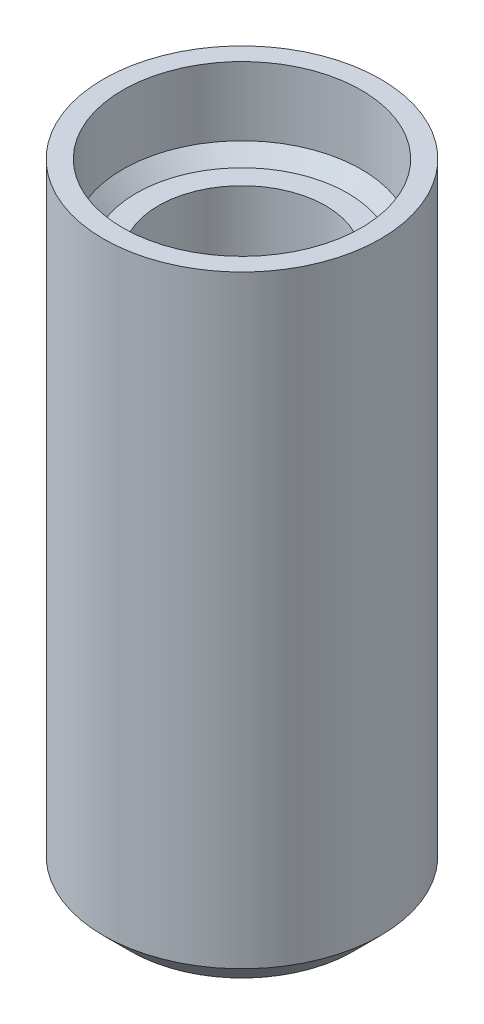
from build123d import *

# Parameters (mm, degrees)
SKETCH1_R           = 5.05
BOSS_EXTRUDE1_DEPTH = 20
SKETCH2_R           = 5.05
BOSS_EXTRUDE2_DEPTH = 2
SKETCH4_R           = 5.05
SKETCH4_R_2         = 4.35
BOSS_EXTRUDE3_DEPTH = 3
CHAMFER1_SIZE       = 1
CHAMFER2_SIZE       = 0.5
CUT_EXTRUDE1_DEPTH  = 0.4
BOSS_EXTRUDE4_DEPTH = 0.4


with BuildPart() as part:
    # Sketch1 → Boss-Extrude1 (new body)
    with BuildSketch(Plane(origin=(0, 0, 0), x_dir=(1, 0, 0), z_dir=(0, 1, 0))):
        Circle(SKETCH1_R)
        with BuildLine():
            Line((2.565151068, -1.65), (-2.565151068, -1.65))
            ThreePointArc((-2.565151068, -1.65), (0, 3.05), (2.565151068, -1.65))
        make_face(mode=Mode.SUBTRACT)
    extrude(amount=BOSS_EXTRUDE1_DEPTH)

    # Sketch2 → Boss-Extrude2 (add)
    with BuildSketch(Plane.XZ):
        Circle(SKETCH2_R)
    extrude(amount=-BOSS_EXTRUDE2_DEPTH)

    # Sketch4 → Boss-Extrude3 (add)
    with BuildSketch(Plane(origin=(0, 20, 0), x_dir=(1, 0, 0), z_dir=(0, 1, 0))):
        Circle(SKETCH4_R)
        Circle(SKETCH4_R_2, mode=Mode.SUBTRACT)
    extrude(amount=BOSS_EXTRUDE3_DEPTH)

    # Chamfer1
    chamfer1_edges = [part.edges().sort_by_distance(p)[0] for p in [
        (-5.05, 0, 0),
    ]]
    chamfer(chamfer1_edges, length=CHAMFER1_SIZE)

    # Chamfer2
    chamfer2_edges = [part.edges().sort_by_distance(p)[0] for p in [
        (-4.35, 20, 0),
    ]]
    chamfer(chamfer2_edges, length=CHAMFER2_SIZE)

    # Sketch5 → Cut-Extrude1 (cut)
    with BuildSketch(Plane.XZ):
        with BuildLine():
            add(Edge.make_bspline(
                [(1.503946302, -1.646012639), (1.503796634, -1.675709231), (1.503520327, -1.730533461), (1.495832603, -1.805869401), (1.487293188, -1.868599812), (1.472061145, -1.918250208), (1.45431425, -1.957451391), (1.427848022, -1.98313015), (1.397106461, -1.996710383), (1.37573713, -1.998896559), (1.364951265, -2)],
                knots=[0, 0, 0, 0, 1.700477232, 3.139328327, 4.338937117, 5.31779253, 6.112293145, 6.774269824, 7.381330181, 8, 8, 8, 8], degree=3))
            Line((1.364951265, -2), (-1.157958655, -2))
            add(Edge.make_bspline(
                [(-1.157958655, -2), (-1.181313286, -1.999513937), (-1.224943688, -1.998605888), (-1.285890084, -1.989774463), (-1.337523453, -1.969798779), (-1.37949423, -1.935892981), (-1.408860562, -1.885251871), (-1.4282837, -1.818630591), (-1.437844273, -1.733279924), (-1.439198719, -1.670030244), (-1.439948587, -1.635013032)],
                knots=[0, 0, 0, 0, 1.025949817, 1.916647791, 2.69162005, 3.43032923, 4.23901448, 5.220859075, 6.461371377, 8, 8, 8, 8], degree=3))
            add(Edge.make_bspline(
                [(-1.439948587, -1.635013032), (-1.439245035, -1.601007994), (-1.437946587, -1.538249658), (-1.431888841, -1.450483653), (-1.418165094, -1.374786106), (-1.395715272, -1.307311278), (-1.363372901, -1.246306319), (-1.325730064, -1.184944159), (-1.275906436, -1.123330328), (-1.238197207, -1.082141796), (-1.217956513, -1.060033561)],
                knots=[0, 0, 0, 0, 1.279770231, 2.361892714, 3.306414937, 4.167028953, 5.025172171, 5.898575693, 6.872045744, 8, 8, 8, 8], degree=3))
            Line((-1.217956513, -1.060033561), (-0.476982969, -0.264061981))
            add(Edge.make_bspline(
                [(-0.476982969, -0.264061981), (-0.441772073, -0.225587056), (-0.373682014, -0.151185089), (-0.27859937, -0.040435139), (-0.19460351, 0.06536146), (-0.121175016, 0.165976738), (-0.056513558, 0.261746), (-0.000109902, 0.352985079), (0.049805762, 0.439759759), (0.104121058, 0.547034863), (0.15661464, 0.673242398), (0.197776339, 0.818084735), (0.219343407, 0.952548313), (0.222480508, 1.039159601), (0.223992002, 1.080889997)],
                knots=[0, 0, 0, 0, 1.20947157, 2.338849612, 3.384319872, 4.341377303, 5.226828348, 6.063423144, 6.828539773, 7.547598628, 8.851019864, 9.991402106, 11.032232556, 12, 12, 12, 12], degree=3))
            add(Edge.make_bspline(
                [(0.223992002, 1.080889997), (0.222220689, 1.114393803), (0.218711767, 1.180763892), (0.192050769, 1.276220615), (0.149092524, 1.364067272), (0.086764758, 1.439677843), (0.008353365, 1.503649766), (-0.089048018, 1.549215472), (-0.20359379, 1.579115128), (-0.286110329, 1.582220675), (-0.329988218, 1.583872038)],
                knots=[0, 0, 0, 0, 0.952592796, 1.887059298, 2.799298945, 3.716508085, 4.654435942, 5.655858967, 6.753510967, 8, 8, 8, 8], degree=3))
            add(Edge.make_bspline(
                [(-0.329988218, 1.583872038), (-0.362005104, 1.583306935), (-0.424172808, 1.582209663), (-0.514874087, 1.57340374), (-0.599665222, 1.557205823), (-0.702930583, 1.529683381), (-0.81907888, 1.486687777), (-0.942649229, 1.428835108), (-1.047088338, 1.370419263), (-1.122366572, 1.32500387), (-1.172462711, 1.292012095), (-1.205137878, 1.277565428), (-1.232842043, 1.265883101), (-1.250868706, 1.264502686), (-1.258955049, 1.263883464)],
                knots=[0, 0, 0, 0, 1.155956231, 2.244538859, 3.28550842, 4.269318886, 6.100628768, 7.748195433, 9.191883973, 10.417953324, 10.925724687, 11.351067817, 11.708904068, 12, 12, 12, 12], degree=3))
            add(Edge.make_bspline(
                [(-1.258955049, 1.263883464), (-1.268547005, 1.264741423), (-1.287866311, 1.266469454), (-1.313745241, 1.284987713), (-1.333989674, 1.314859809), (-1.348244132, 1.358394834), (-1.359473666, 1.416162587), (-1.369532054, 1.490259329), (-1.375006138, 1.581791826), (-1.375617813, 1.648529508), (-1.375950872, 1.684868432)],
                knots=[0, 0, 0, 0, 0.485692822, 0.97824142, 1.565816375, 2.311318477, 3.305989244, 4.581102635, 6.138397226, 8, 8, 8, 8], degree=3))
            add(Edge.make_bspline(
                [(-1.375950872, 1.684868432), (-1.375937002, 1.709545239), (-1.375911861, 1.75427285), (-1.371523326, 1.815972977), (-1.366099701, 1.867524035), (-1.357104509, 1.911433051), (-1.345047238, 1.948985947), (-1.329254918, 1.983916951), (-1.303909621, 2.018746992), (-1.275231611, 2.050212392), (-1.241920999, 2.078117721), (-1.20701747, 2.102610932), (-1.163511995, 2.130041563), (-1.089415303, 2.169731561), (-0.979826679, 2.223031825), (-0.827501283, 2.280650326), (-0.65431417, 2.333995035), (-0.463979338, 2.379209561), (-0.260322783, 2.410454495), (-0.120112449, 2.414029237), (-0.048998251, 2.415842333)],
                knots=[0, 0, 0, 0, 0.788292368, 1.428808632, 1.975788089, 2.443732868, 2.858052408, 3.234493626, 3.66294862, 4.228288178, 4.591069522, 5.049213324, 5.590039132, 6.233559628, 7.734267659, 9.480939635, 11.431700141, 13.521863135, 15.728704436, 18, 18, 18, 18], degree=3))
            add(Edge.make_bspline(
                [(-0.048998251, 2.415842333), (0.006376737, 2.415033437), (0.113708469, 2.413465576), (0.269501976, 2.397082983), (0.414556565, 2.370915897), (0.548479175, 2.332310402), (0.671597029, 2.285498209), (0.784570996, 2.230714038), (0.886048284, 2.16643306), (0.976827094, 2.09388449), (1.0567917, 2.014173678), (1.126183469, 1.926723625), (1.183750038, 1.831780782), (1.231167288, 1.730209238), (1.266736398, 1.622963463), (1.292559642, 1.511830329), (1.309510379, 1.396730746), (1.311129708, 1.318608879), (1.311953157, 1.278882928)],
                knots=[0, 0, 0, 0, 1.324900052, 2.568015312, 3.744666331, 4.8481595, 5.898614886, 6.894039723, 7.847934722, 8.767415271, 9.669989851, 10.544631889, 11.43259769, 12.321315746, 13.221949113, 14.131442766, 15.049815173, 16, 16, 16, 16], degree=3))
            add(Edge.make_bspline(
                [(1.311953157, 1.278882928), (1.309995892, 1.208454352), (1.306091411, 1.067958786), (1.280552537, 0.892942461), (1.24830755, 0.752470187), (1.210908684, 0.644005984), (1.165445165, 0.530557794), (1.106374763, 0.413589462), (1.036919583, 0.290614629), (0.954715609, 0.16184909), (0.859436164, 0.026864235), (0.75033226, -0.11494206), (0.626236799, -0.266261019), (0.484161484, -0.427999209), (0.322760295, -0.60074129), (0.207885943, -0.718597632), (0.147994716, -0.780043558)],
                knots=[0, 0, 0, 0, 1.214695824, 2.423155294, 3.043825433, 3.698462194, 4.400034292, 5.150962269, 5.956941602, 6.835925221, 7.785176393, 8.806499493, 9.921972916, 11.160753287, 12.51972206, 14, 14, 14, 14], degree=3))
            Line((0.147994716, -0.780043558), (-0.351987432, -1.296025135))
            Line((-0.351987432, -1.296025135), (1.353951657, -1.296025135))
            add(Edge.make_bspline(
                [(1.353951657, -1.296025135), (1.364825015, -1.296947224), (1.386659484, -1.298798843), (1.416925115, -1.31580015), (1.444699437, -1.341104261), (1.466398067, -1.379302909), (1.484653853, -1.428051082), (1.495116283, -1.490023895), (1.503684812, -1.563773668), (1.503855039, -1.61731039), (1.503946302, -1.646012639)],
                knots=[0, 0, 0, 0, 0.620001289, 1.24500623, 1.94939785, 2.757032326, 3.738367869, 4.928457297, 6.353276405, 8, 8, 8, 8], degree=3))
        make_face()
    extrude(amount=-CUT_EXTRUDE1_DEPTH, mode=Mode.SUBTRACT)


with BuildPart() as body_2:
    # Sketch5<2> → Boss-Extrude4 (new body)
    with BuildSketch(Plane.XZ):
        with BuildLine():
            add(Edge.make_bspline(
                [(1.503946302, -1.646012639), (1.503796634, -1.675709231), (1.503520327, -1.730533461), (1.495832603, -1.805869401), (1.487293188, -1.868599812), (1.472061145, -1.918250208), (1.45431425, -1.957451391), (1.427848022, -1.98313015), (1.397106461, -1.996710383), (1.37573713, -1.998896559), (1.364951265, -2)],
                knots=[0, 0, 0, 0, 1.700477232, 3.139328327, 4.338937117, 5.31779253, 6.112293145, 6.774269824, 7.381330181, 8, 8, 8, 8], degree=3))
            Line((1.364951265, -2), (-1.157958655, -2))
            add(Edge.make_bspline(
                [(-1.157958655, -2), (-1.181313286, -1.999513937), (-1.224943688, -1.998605888), (-1.285890084, -1.989774463), (-1.337523453, -1.969798779), (-1.37949423, -1.935892981), (-1.408860562, -1.885251871), (-1.4282837, -1.818630591), (-1.437844273, -1.733279924), (-1.439198719, -1.670030244), (-1.439948587, -1.635013032)],
                knots=[0, 0, 0, 0, 1.025949817, 1.916647791, 2.69162005, 3.43032923, 4.23901448, 5.220859075, 6.461371377, 8, 8, 8, 8], degree=3))
            add(Edge.make_bspline(
                [(-1.439948587, -1.635013032), (-1.439245035, -1.601007994), (-1.437946587, -1.538249658), (-1.431888841, -1.450483653), (-1.418165094, -1.374786106), (-1.395715272, -1.307311278), (-1.363372901, -1.246306319), (-1.325730064, -1.184944159), (-1.275906436, -1.123330328), (-1.238197207, -1.082141796), (-1.217956513, -1.060033561)],
                knots=[0, 0, 0, 0, 1.279770231, 2.361892714, 3.306414937, 4.167028953, 5.025172171, 5.898575693, 6.872045744, 8, 8, 8, 8], degree=3))
            Line((-1.217956513, -1.060033561), (-0.476982969, -0.264061981))
            add(Edge.make_bspline(
                [(-0.476982969, -0.264061981), (-0.441772073, -0.225587056), (-0.373682014, -0.151185089), (-0.27859937, -0.040435139), (-0.19460351, 0.06536146), (-0.121175016, 0.165976738), (-0.056513558, 0.261746), (-0.000109902, 0.352985079), (0.049805762, 0.439759759), (0.104121058, 0.547034863), (0.15661464, 0.673242398), (0.197776339, 0.818084735), (0.219343407, 0.952548313), (0.222480508, 1.039159601), (0.223992002, 1.080889997)],
                knots=[0, 0, 0, 0, 1.20947157, 2.338849612, 3.384319872, 4.341377303, 5.226828348, 6.063423144, 6.828539773, 7.547598628, 8.851019864, 9.991402106, 11.032232556, 12, 12, 12, 12], degree=3))
            add(Edge.make_bspline(
                [(0.223992002, 1.080889997), (0.222220689, 1.114393803), (0.218711767, 1.180763892), (0.192050769, 1.276220615), (0.149092524, 1.364067272), (0.086764758, 1.439677843), (0.008353365, 1.503649766), (-0.089048018, 1.549215472), (-0.20359379, 1.579115128), (-0.286110329, 1.582220675), (-0.329988218, 1.583872038)],
                knots=[0, 0, 0, 0, 0.952592796, 1.887059298, 2.799298945, 3.716508085, 4.654435942, 5.655858967, 6.753510967, 8, 8, 8, 8], degree=3))
            add(Edge.make_bspline(
                [(-0.329988218, 1.583872038), (-0.362005104, 1.583306935), (-0.424172808, 1.582209663), (-0.514874087, 1.57340374), (-0.599665222, 1.557205823), (-0.702930583, 1.529683381), (-0.81907888, 1.486687777), (-0.942649229, 1.428835108), (-1.047088338, 1.370419263), (-1.122366572, 1.32500387), (-1.172462711, 1.292012095), (-1.205137878, 1.277565428), (-1.232842043, 1.265883101), (-1.250868706, 1.264502686), (-1.258955049, 1.263883464)],
                knots=[0, 0, 0, 0, 1.155956231, 2.244538859, 3.28550842, 4.269318886, 6.100628768, 7.748195433, 9.191883973, 10.417953324, 10.925724687, 11.351067817, 11.708904068, 12, 12, 12, 12], degree=3))
            add(Edge.make_bspline(
                [(-1.258955049, 1.263883464), (-1.268547005, 1.264741423), (-1.287866311, 1.266469454), (-1.313745241, 1.284987713), (-1.333989674, 1.314859809), (-1.348244132, 1.358394834), (-1.359473666, 1.416162587), (-1.369532054, 1.490259329), (-1.375006138, 1.581791826), (-1.375617813, 1.648529508), (-1.375950872, 1.684868432)],
                knots=[0, 0, 0, 0, 0.485692822, 0.97824142, 1.565816375, 2.311318477, 3.305989244, 4.581102635, 6.138397226, 8, 8, 8, 8], degree=3))
            add(Edge.make_bspline(
                [(-1.375950872, 1.684868432), (-1.375937002, 1.709545239), (-1.375911861, 1.75427285), (-1.371523326, 1.815972977), (-1.366099701, 1.867524035), (-1.357104509, 1.911433051), (-1.345047238, 1.948985947), (-1.329254918, 1.983916951), (-1.303909621, 2.018746992), (-1.275231611, 2.050212392), (-1.241920999, 2.078117721), (-1.20701747, 2.102610932), (-1.163511995, 2.130041563), (-1.089415303, 2.169731561), (-0.979826679, 2.223031825), (-0.827501283, 2.280650326), (-0.65431417, 2.333995035), (-0.463979338, 2.379209561), (-0.260322783, 2.410454495), (-0.120112449, 2.414029237), (-0.048998251, 2.415842333)],
                knots=[0, 0, 0, 0, 0.788292368, 1.428808632, 1.975788089, 2.443732868, 2.858052408, 3.234493626, 3.66294862, 4.228288178, 4.591069522, 5.049213324, 5.590039132, 6.233559628, 7.734267659, 9.480939635, 11.431700141, 13.521863135, 15.728704436, 18, 18, 18, 18], degree=3))
            add(Edge.make_bspline(
                [(-0.048998251, 2.415842333), (0.006376737, 2.415033437), (0.113708469, 2.413465576), (0.269501976, 2.397082983), (0.414556565, 2.370915897), (0.548479175, 2.332310402), (0.671597029, 2.285498209), (0.784570996, 2.230714038), (0.886048284, 2.16643306), (0.976827094, 2.09388449), (1.0567917, 2.014173678), (1.126183469, 1.926723625), (1.183750038, 1.831780782), (1.231167288, 1.730209238), (1.266736398, 1.622963463), (1.292559642, 1.511830329), (1.309510379, 1.396730746), (1.311129708, 1.318608879), (1.311953157, 1.278882928)],
                knots=[0, 0, 0, 0, 1.324900052, 2.568015312, 3.744666331, 4.8481595, 5.898614886, 6.894039723, 7.847934722, 8.767415271, 9.669989851, 10.544631889, 11.43259769, 12.321315746, 13.221949113, 14.131442766, 15.049815173, 16, 16, 16, 16], degree=3))
            add(Edge.make_bspline(
                [(1.311953157, 1.278882928), (1.309995892, 1.208454352), (1.306091411, 1.067958786), (1.280552537, 0.892942461), (1.24830755, 0.752470187), (1.210908684, 0.644005984), (1.165445165, 0.530557794), (1.106374763, 0.413589462), (1.036919583, 0.290614629), (0.954715609, 0.16184909), (0.859436164, 0.026864235), (0.75033226, -0.11494206), (0.626236799, -0.266261019), (0.484161484, -0.427999209), (0.322760295, -0.60074129), (0.207885943, -0.718597632), (0.147994716, -0.780043558)],
                knots=[0, 0, 0, 0, 1.214695824, 2.423155294, 3.043825433, 3.698462194, 4.400034292, 5.150962269, 5.956941602, 6.835925221, 7.785176393, 8.806499493, 9.921972916, 11.160753287, 12.51972206, 14, 14, 14, 14], degree=3))
            Line((0.147994716, -0.780043558), (-0.351987432, -1.296025135))
            Line((-0.351987432, -1.296025135), (1.353951657, -1.296025135))
            add(Edge.make_bspline(
                [(1.353951657, -1.296025135), (1.364825015, -1.296947224), (1.386659484, -1.298798843), (1.416925115, -1.31580015), (1.444699437, -1.341104261), (1.466398067, -1.379302909), (1.484653853, -1.428051082), (1.495116283, -1.490023895), (1.503684812, -1.563773668), (1.503855039, -1.61731039), (1.503946302, -1.646012639)],
                knots=[0, 0, 0, 0, 0.620001289, 1.24500623, 1.94939785, 2.757032326, 3.738367869, 4.928457297, 6.353276405, 8, 8, 8, 8], degree=3))
        make_face()
    extrude(amount=-BOSS_EXTRUDE4_DEPTH)


solid = Compound([part.part, body_2.part])
